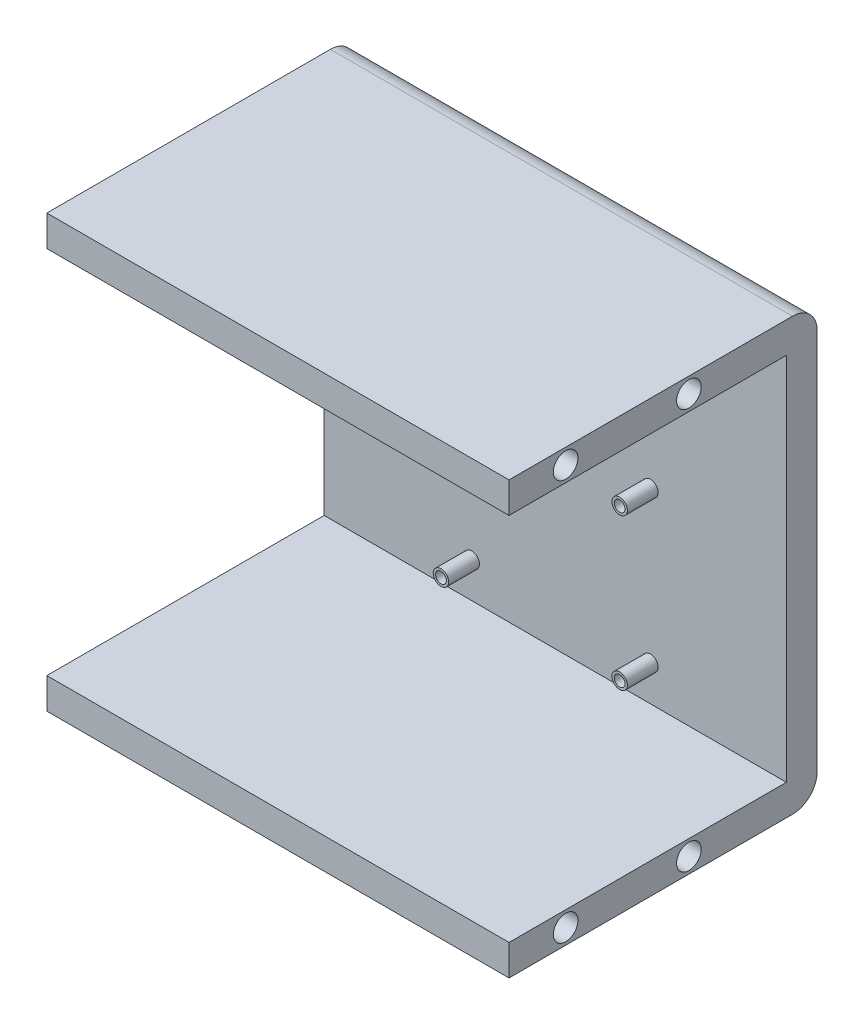
from build123d import *

# Parameters (mm, degrees)
SKETCH1_W               = 150
SKETCH1_H               = 120
BOSS_EXTRUDE1_DEPTH     = 10
SKETCH2_R               = 4
CUT_EXTRUDE1_DEPTH      = 30
CROQUIS4_R              = 2.5
SALIENTE_EXTRUIR2_DEPTH = 10
CROQUIS5_R              = 1.75
CORTAR_EXTRUIR1_DEPTH   = 9
CROQUIS6_W              = 150
CROQUIS6_H              = 100
SALIENTE_EXTRUIR3_DEPTH = 10
CROQUIS9_W              = 150
CROQUIS9_H              = 100
SALIENTE_EXTRUIR4_DEPTH = 10
CROQUIS10_R             = 4
CORTAR_EXTRUIR2_DEPTH   = 30
FILLET1_R               = 8


with BuildPart() as part:
    # Sketch1 → Boss-Extrude1 (new body)
    with BuildSketch(Plane.XY):
        with Locations((75, 0)):
            Rectangle(SKETCH1_W, SKETCH1_H)
    extrude(amount=BOSS_EXTRUDE1_DEPTH)

    # Sketch2 → Cut-Extrude1 (cut)
    with BuildSketch(Plane.ZY):
        with Locations((5, 0)):
            Circle(SKETCH2_R)
        with Locations((5, 30)):
            Circle(SKETCH2_R)
        with Locations((5, -30)):
            Circle(SKETCH2_R)
    extrude(amount=-CUT_EXTRUDE1_DEPTH, mode=Mode.SUBTRACT)

    # Croquis4 → Saliente-Extruir2 (add)
    with BuildSketch(Plane.XY.offset(10)):
        with Locations((47.900115216, 0.5)):
            Circle(CROQUIS4_R)
        with Locations((105.9, 0.615607451)):
            Circle(CROQUIS4_R)
        with Locations((105.9, -48.5)):
            Circle(CROQUIS4_R)
        with Locations((47.900115216, -48.5)):
            Circle(CROQUIS4_R)
    extrude(amount=SALIENTE_EXTRUIR2_DEPTH)

    # Croquis5 → Cortar-Extruir1 (cut)
    with BuildSketch(Plane.XY.offset(20)):
        with Locations((47.900115216, 0.5)):
            Circle(CROQUIS5_R)
        with Locations((47.900115216, -48.5)):
            Circle(CROQUIS5_R)
        with Locations((105.9, -48.5)):
            Circle(CROQUIS5_R)
        with Locations((105.9, 0.615607451)):
            Circle(CROQUIS5_R)
    extrude(amount=-CORTAR_EXTRUIR1_DEPTH, mode=Mode.SUBTRACT)

    # Croquis6 → Saliente-Extruir3 (add)
    with BuildSketch(Plane.XZ.offset(60)):
        with Locations((75, 50)):
            Rectangle(CROQUIS6_W, CROQUIS6_H)
    extrude(amount=SALIENTE_EXTRUIR3_DEPTH)

    # Croquis9 → Saliente-Extruir4 (add)
    with BuildSketch(Plane(origin=(0, 60, 0), x_dir=(1, 0, 0), z_dir=(0, 1, 0))):
        with Locations((75, -50)):
            Rectangle(CROQUIS9_W, CROQUIS9_H)
    extrude(amount=SALIENTE_EXTRUIR4_DEPTH)

    # Croquis10 → Cortar-Extruir2 (cut)
    with BuildSketch(Plane(origin=(150, 0, 0), x_dir=(0, 0, -1), z_dir=(1, 0, 0))):
        with Locations((-81.62673219, 65)):
            Circle(CROQUIS10_R)
        with Locations((-41.62673219, 65)):
            Circle(CROQUIS10_R)
        with Locations((-81.62673219, -65)):
            Circle(CROQUIS10_R)
        with Locations((-41.62673219, -65)):
            Circle(CROQUIS10_R)
    extrude(amount=-CORTAR_EXTRUIR2_DEPTH, mode=Mode.SUBTRACT)

    # Fillet1
    fillet1_edges = [part.edges().sort_by_distance(p)[0] for p in [
        (75, -70, 0),
        (75, 70, 0),
    ]]
    fillet(fillet1_edges, radius=FILLET1_R)


solid = part.part
